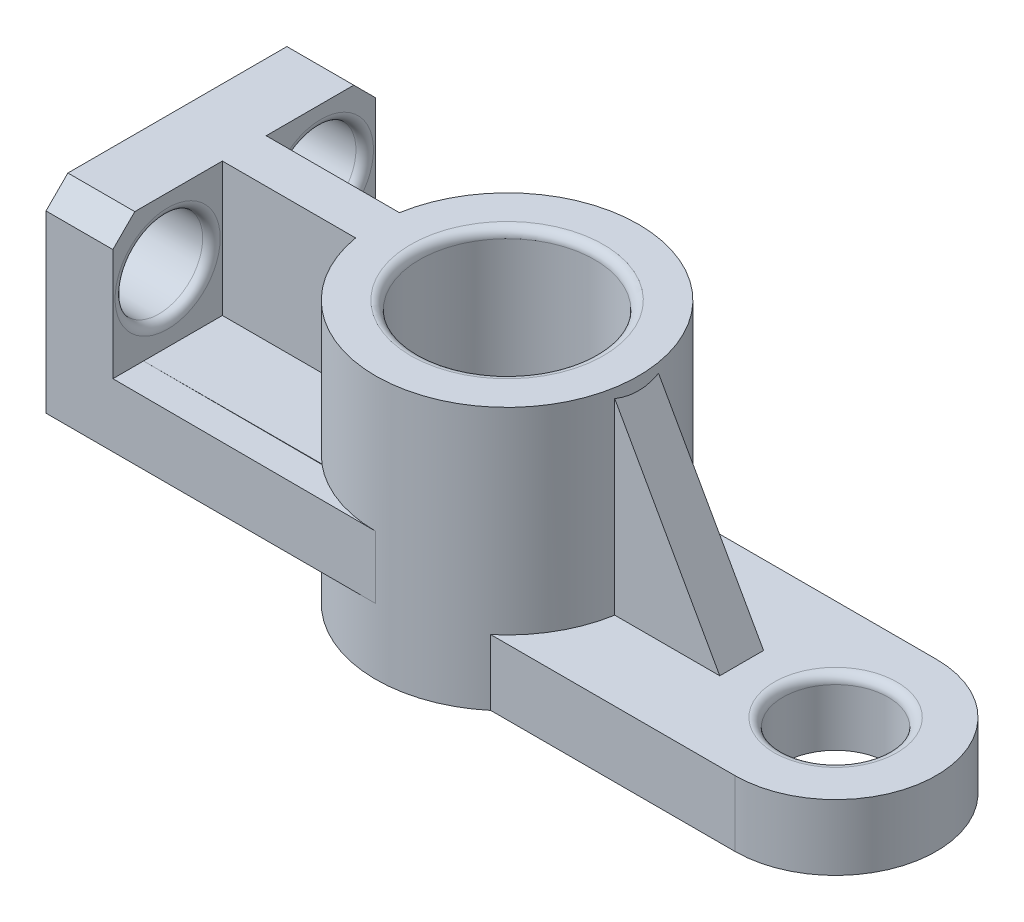
from build123d import *

# Parameters (mm, degrees)
SKETCH1_R           = 30
SKETCH1_R_2         = 20
BOSS_EXTRUDE1_DEPTH = 60
FILLET1_R           = 2
SKETCH2_R           = 12
BOSS_EXTRUDE2_DEPTH = 15
SKETCH3_W           = 60
SKETCH3_H           = 14.46101051
BOSS_EXTRUDE3_DEPTH = 46
BOSS_EXTRUDE4_DEPTH = 46
SKETCH5_W           = 30.419601085
SKETCH5_H           = 10
BOSS_EXTRUDE5_DEPTH = 40
BOSS_EXTRUDE6_DEPTH = 7
BOSS_EXTRUDE7_DEPTH = 7
SKETCH13_R          = 10
CUT_EXTRUDE1_DEPTH  = 175.795811421
CHAMFER3_SIZE       = 5
FILLET2_R           = 2
BOSS_EXTRUDE8_DEPTH = 5
CUT_EXTRUDE2_DEPTH  = 112.920532385


with BuildPart() as part:
    # Sketch1 → Boss-Extrude1 (new body)
    with BuildSketch(Plane(origin=(0, 0, 0), x_dir=(1, 0, 0), z_dir=(0, 1, 0))):
        with Locations(Location((0, 14.604659961, 0), (0, 0, 270))):
            Circle(SKETCH1_R)
        with Locations(Location((0, 14.604659961, 0), (0, 0, 270))):
            Circle(SKETCH1_R_2, mode=Mode.SUBTRACT)
    extrude(amount=BOSS_EXTRUDE1_DEPTH)

    # Fillet1
    fillet1_edges = [part.edges().sort_by_distance(p)[0] for p in [
        (0, 60, -34.604659961),
    ]]
    fillet(fillet1_edges, radius=FILLET1_R)

    # Sketch2 → Boss-Extrude2 (add)
    with BuildSketch(Plane(origin=(0, 0, 0), x_dir=(1, 0, 0), z_dir=(0, 1, 0))):
        with BuildLine():
            Line((19.261360284, 37.604659961), (19.261360284, -8.395340039))
            Line((19.261360284, -8.395340039), (75, -8.395340039))
            ThreePointArc((75, -8.395340039), (98, 14.604659961), (75, 37.604659961))
            Line((75, 37.604659961), (19.261360284, 37.604659961))
        make_face()
        with Locations(Location((75, 14.604659961, 0), (0, 0, 270))):
            Circle(SKETCH2_R, mode=Mode.SUBTRACT)
    extrude(amount=BOSS_EXTRUDE2_DEPTH)

    # Sketch3 → Boss-Extrude3 (add)
    with BuildSketch(Plane.XY.offset(8.395340039)):
        with Locations((-30, 22.230505255)):
            Rectangle(SKETCH3_W, SKETCH3_H)
    extrude(amount=-BOSS_EXTRUDE3_DEPTH)

    # Sketch4 → Boss-Extrude4 (add)
    with BuildSketch(Plane.XY.offset(8.395340039)):
        Polygon((-60, 29.46101051), (-60, 60), (-75.269401646, 60), (-75.269401646, 15), (-60, 15), align=None)
    extrude(amount=-BOSS_EXTRUDE4_DEPTH)

    # Sketch5 → Boss-Extrude5 (add)
    with BuildSketch(Plane(origin=(0, 60, 0), x_dir=(1, 0, 0), z_dir=(0, 1, 0))):
        with Locations((-44.790199458, 14.604659961)):
            Rectangle(SKETCH5_W, SKETCH5_H)
    extrude(amount=-BOSS_EXTRUDE5_DEPTH)

    # Sketch9 → Boss-Extrude6 (add)
    with BuildSketch(Plane.XY.offset(8.395340039)):
        Polygon((-60, 60), (-75.269401646, 60), (-75.269401646, 15), (0, 15), (0, 29.299005419), (-60, 29.46101051), align=None)
    extrude(amount=BOSS_EXTRUDE6_DEPTH)

    # Sketch11 → Boss-Extrude7 (add)
    with BuildSketch(Plane(origin=(0, 0, -37.604659961), x_dir=(-1, 0, 0), z_dir=(0, 0, -1))):
        Polygon((19.261360284, 15), (75.269401646, 15), (75.269401646, 60), (60, 60), (60, 29.46101051), (19.261360284, 29.46101051), (0, 29.46101051), (0, 15), align=None)
    extrude(amount=BOSS_EXTRUDE7_DEPTH)

    # Sketch13 → Cut-Extrude1 (cut, through all)
    with BuildSketch(Plane(origin=(-60, 0, 0), x_dir=(0, 0, -1), z_dir=(1, 0, 0))):
        with Locations((-2.895340039, 45)):
            Circle(SKETCH13_R)
        with Locations((32.104659961, 45)):
            Circle(SKETCH13_R)
    extrude(amount=-CUT_EXTRUDE1_DEPTH, mode=Mode.SUBTRACT)

    # Chamfer3
    chamfer3_edges = [part.edges().sort_by_distance(p)[0] for p in [
        (-67.634700823, 60, 15.395340039),
        (-67.634700823, 60, -44.604659961),
    ]]
    chamfer(chamfer3_edges, length=CHAMFER3_SIZE)

    # Fillet2
    fillet2_edges = [part.edges().sort_by_distance(p)[0] for p in [
        (-60, 45, 12.895340039),
        (-60, 45, -22.104659961),
        (75, 15, -26.604659961),
    ]]
    fillet(fillet2_edges, radius=FILLET2_R)

    # Sketch14 → Boss-Extrude8 (add, symmetric)
    with BuildSketch(Plane.XY.offset(-14.604659961)):
        Polygon((28.35670002, 60), (53.55670002, 15), (28.35670002, 15), align=None)
    extrude(amount=BOSS_EXTRUDE8_DEPTH, both=True)

    # Sketch15 → Cut-Extrude2 (cut, through all)
    with BuildSketch(Plane(origin=(0, 29.46101051, 0), x_dir=(1, 0, 0), z_dir=(0, 1, 0))):
        with BuildLine():
            Line((0, 34.604659961), (0, -5.395340039))
            ThreePointArc((0, -5.395340039), (-20, 14.604659961), (0, 34.604659961))
        make_face()
    extrude(amount=-CUT_EXTRUDE2_DEPTH, mode=Mode.SUBTRACT)


solid = part.part
